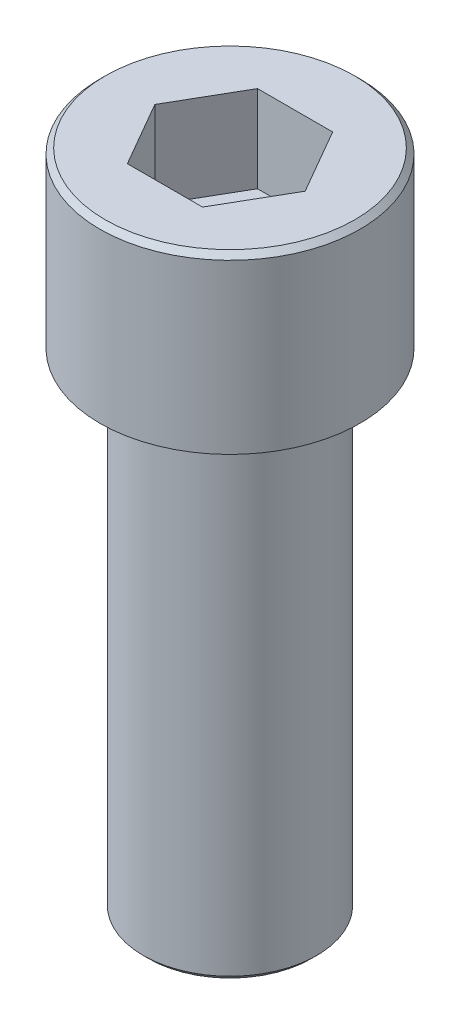
from build123d import *

# Parameters (mm, degrees)
CUT_EXTRUDE1_DEPTH = 8
CHAMFER1_SIZE      = 0.5
CUT_EXTRUDE2_DEPTH = 0.1


with BuildPart() as part:
    # Sketch1 → Base-Revolve (revolve)
    with BuildSketch(Plane.XY, mode=Mode.PRIVATE) as base_revolve_sk:
        Polygon((0, 0), (8, 0), (8, 45), (12, 45), (12, 61), (0, 61), align=None)
    revolve(base_revolve_sk.sketch.rotate(Axis((0, 0, 0), (0, 1, 0)), 90), axis=Axis((0, 0, 0), (0, 1, 0)))

    # Sketch2 → Cut-Extrude1 (cut)
    with BuildSketch(Plane(origin=(0, 61, 0), x_dir=(-1, 0, 0), z_dir=(0, 1, 0))):
        Polygon((3.464101615, -6), (-3.464101615, -6), (-6.92820323, 0), (-3.464101615, 6), (3.464101615, 6), (6.92820323, 0), align=None)
    extrude(amount=-CUT_EXTRUDE1_DEPTH, mode=Mode.SUBTRACT)

    # Chamfer1
    chamfer1_edges = [part.edges().sort_by_distance(p)[0] for p in [
        (0, 61, 12),
        (0, 0, 8),
    ]]
    chamfer(chamfer1_edges, length=CHAMFER1_SIZE)

    # Sketch3 → Cut-Extrude2 (cut)
    # profile 1 of 3: a face of its own
    with BuildSketch(Plane(origin=(0, 53, 0), x_dir=(1, 0, 0), z_dir=(0, 1, 0))):
        with BuildLine():
            add(Edge.make_bspline(
                [(-1.556991186, -1.607271635), (-1.536527938, -1.617941603), (-1.49661777, -1.638751605), (-1.439776907, -1.672259339), (-1.387830478, -1.707574314), (-1.339337219, -1.743028499), (-1.295149112, -1.779979679), (-1.255760245, -1.818574791), (-1.22019766, -1.857850466), (-1.189178528, -1.89847178), (-1.161895074, -1.940330815), (-1.138314977, -1.983537439), (-1.118159832, -2.027996963), (-1.102186304, -2.074194699), (-1.089027882, -2.121452028), (-1.079973878, -2.170379158), (-1.075104651, -2.220653688), (-1.07418407, -2.254631046), (-1.073717949, -2.271834936)],
                knots=[0, 0, 0, 0, 1.272397273, 2.481599622, 3.635517121, 4.734568067, 5.792894095, 6.808321871, 7.773003508, 8.711915296, 9.623354172, 10.525449501, 11.423591555, 12.311487226, 13.218079475, 14.126165749, 15.051214107, 16, 16, 16, 16], degree=3))
            add(Edge.make_bspline(
                [(-1.073717949, -2.271834936), (-1.074268963, -2.295904745), (-1.075359628, -2.343547928), (-1.084859617, -2.413866579), (-1.099083173, -2.482160709), (-1.119854253, -2.548415346), (-1.146792389, -2.612264898), (-1.179990129, -2.673764022), (-1.217569562, -2.733920671), (-1.247749732, -2.77093453), (-1.263020833, -2.789663462)],
                knots=[0, 0, 0, 0, 1.025265484, 2.029385089, 3.018602448, 3.995076438, 4.983346944, 5.966715145, 6.97116228, 8, 8, 8, 8], degree=3))
            add(Edge.make_bspline(
                [(-1.263020833, -2.789663462), (-1.282904029, -2.811516157), (-1.322424719, -2.854951509), (-1.39012681, -2.911344945), (-1.464428156, -2.958737369), (-1.54504125, -2.997360151), (-1.631750609, -3.027421479), (-1.724537755, -3.049023277), (-1.823583578, -3.061396441), (-1.891658915, -3.063185005), (-1.926582532, -3.064102564)],
                knots=[0, 0, 0, 0, 0.954267603, 1.896743057, 2.838368354, 3.796610408, 4.779680527, 5.799409237, 6.871065594, 8, 8, 8, 8], degree=3))
            add(Edge.make_bspline(
                [(-1.926582532, -3.064102564), (-1.960163524, -3.063279366), (-2.025508723, -3.061677505), (-2.120621493, -3.050824339), (-2.209280828, -3.031804435), (-2.292002234, -3.005772571), (-2.368287015, -2.971908122), (-2.437917802, -2.929759259), (-2.501899211, -2.881022514), (-2.558289549, -2.824298173), (-2.608352723, -2.76354255), (-2.652329904, -2.700862828), (-2.688882817, -2.636253287), (-2.719830742, -2.570677311), (-2.743522187, -2.503215772), (-2.759930909, -2.434215763), (-2.770351847, -2.363797803), (-2.771738372, -2.316275194), (-2.772435897, -2.292367788)],
                knots=[0, 0, 0, 0, 1.256902934, 2.445805442, 3.576955095, 4.645999104, 5.686449165, 6.692658513, 7.68621702, 8.689161843, 9.678783111, 10.630372946, 11.551080876, 12.453998257, 13.34127905, 14.221779781, 15.105423033, 16, 16, 16, 16], degree=3))
            add(Edge.make_bspline(
                [(-2.772435897, -2.292367788), (-2.772023125, -2.274825508), (-2.771207342, -2.240155771), (-2.765561022, -2.188934823), (-2.756483549, -2.139080441), (-2.744155366, -2.090408481), (-2.72744749, -2.043273286), (-2.707274538, -1.997451519), (-2.683751714, -1.952891449), (-2.656550882, -1.909349391), (-2.624906579, -1.867435453), (-2.589075401, -1.826438314), (-2.548341209, -1.786994124), (-2.503157167, -1.748620963), (-2.454039639, -1.710638124), (-2.399712831, -1.675098318), (-2.341616926, -1.639485486), (-2.30032735, -1.618193825), (-2.279146635, -1.607271635)],
                knots=[0, 0, 0, 0, 0.941657376, 1.861047343, 2.762797495, 3.66048619, 4.553285746, 5.444104102, 6.34607688, 7.256116206, 8.197091036, 9.162375105, 10.176350973, 11.237807142, 12.343728897, 13.50695164, 14.721116704, 16, 16, 16, 16], degree=3))
            add(Edge.make_bspline(
                [(-2.279146635, -1.607271635), (-2.308140474, -1.591461086), (-2.364280661, -1.560847437), (-2.438615977, -1.504599719), (-2.502466422, -1.443679851), (-2.554076934, -1.376801426), (-2.594699954, -1.306053659), (-2.622570386, -1.231879193), (-2.641425018, -1.155653397), (-2.643292751, -1.103577543), (-2.644230769, -1.077423878)],
                knots=[0, 0, 0, 0, 1.166880483, 2.259407225, 3.286803203, 4.280235371, 5.237608625, 6.161067461, 7.076446754, 8, 8, 8, 8], degree=3))
            add(Edge.make_bspline(
                [(-2.644230769, -1.077423878), (-2.643062609, -1.050782765), (-2.640714404, -0.997229482), (-2.621726318, -0.917510822), (-2.590783413, -0.839213276), (-2.548696986, -0.762716338), (-2.496277546, -0.690609042), (-2.433387156, -0.625936937), (-2.361527659, -0.569285878), (-2.281057754, -0.521731469), (-2.194460443, -0.483028856), (-2.103092068, -0.456329982), (-2.008544573, -0.438875613), (-1.944189059, -0.436899431), (-1.911558494, -0.435897436)],
                knots=[0, 0, 0, 0, 0.888701115, 1.786444228, 2.72001202, 3.692817113, 4.693886446, 5.687152267, 6.695133018, 7.739871481, 8.800368666, 9.853104506, 10.91144658, 12, 12, 12, 12], degree=3))
            add(Edge.make_bspline(
                [(-1.911558494, -0.435897436), (-1.879770054, -0.436930538), (-1.817086873, -0.438967698), (-1.724947854, -0.455958325), (-1.636787227, -0.484336554), (-1.552909014, -0.52283457), (-1.474814822, -0.570253814), (-1.405813173, -0.627683009), (-1.344861329, -0.692069831), (-1.294443904, -0.764155262), (-1.252898983, -0.840358258), (-1.223969768, -0.92008863), (-1.205432644, -1.001623672), (-1.203094527, -1.056793675), (-1.201923077, -1.084435096)],
                knots=[0, 0, 0, 0, 1.072916533, 2.115669174, 3.151510826, 4.193348718, 5.225979165, 6.227137561, 7.216255879, 8.211077061, 9.189680878, 10.138522389, 11.067357538, 12, 12, 12, 12], degree=3))
            add(Edge.make_bspline(
                [(-1.201923077, -1.084435096), (-1.202947763, -1.111561285), (-1.204960188, -1.164835577), (-1.221888717, -1.242497377), (-1.250398226, -1.315227405), (-1.289322629, -1.383850942), (-1.34005512, -1.447123441), (-1.4019185, -1.505849491), (-1.474419556, -1.560511511), (-1.528891618, -1.591358914), (-1.556991186, -1.607271635)],
                knots=[0, 0, 0, 0, 0.975232327, 1.915300861, 2.843280834, 3.77672583, 4.742871857, 5.749627742, 6.839139064, 8, 8, 8, 8], degree=3))
        make_face()
        with BuildLine():
            add(Edge.make_bspline(
                [(-1.924078526, -0.692307692), (-1.941614816, -0.692773007), (-1.975923466, -0.693683366), (-2.02622966, -0.698439535), (-2.074067065, -0.707691833), (-2.119935494, -0.720005198), (-2.163206074, -0.736639476), (-2.204466471, -0.756207339), (-2.243014463, -0.779997386), (-2.279315394, -0.806683956), (-2.311994519, -0.836036032), (-2.34099777, -0.86661726), (-2.36508928, -0.899028254), (-2.385547215, -0.932462797), (-2.400391156, -0.967913208), (-2.411508516, -1.00429262), (-2.419023796, -1.042060751), (-2.419586932, -1.067872545), (-2.419871795, -1.080929487)],
                knots=[0, 0, 0, 0, 1.203892937, 2.355340988, 3.463153438, 4.544400666, 5.610487187, 6.640501085, 7.674077295, 8.714426146, 9.728707835, 10.68524104, 11.601827946, 12.495867327, 13.368432065, 14.231010473, 15.105153427, 16, 16, 16, 16], degree=3))
            add(Edge.make_bspline(
                [(-2.419871795, -1.080929487), (-2.419380819, -1.093986994), (-2.418410579, -1.119790503), (-2.410906916, -1.157894693), (-2.399723448, -1.195338719), (-2.382115833, -1.231232227), (-2.360997005, -1.266820341), (-2.334931665, -1.301213617), (-2.303868074, -1.334531749), (-2.268848474, -1.36649135), (-2.230697375, -1.396419038), (-2.190280202, -1.422399882), (-2.148104208, -1.444138532), (-2.10460273, -1.462230964), (-2.05933241, -1.476295205), (-2.012570643, -1.486272809), (-1.96430957, -1.492474236), (-1.931609156, -1.493214965), (-1.915064103, -1.493589744)],
                knots=[0, 0, 0, 0, 0.873023192, 1.725219244, 2.590779336, 3.480155217, 4.391973325, 5.357036234, 6.360879153, 7.436073238, 8.526419356, 9.601555421, 10.645666583, 11.697338044, 12.750135903, 13.812665442, 14.89329948, 16, 16, 16, 16], degree=3))
            add(Edge.make_bspline(
                [(-1.915064103, -1.493589744), (-1.893814028, -1.492966267), (-1.851523766, -1.491725472), (-1.789181386, -1.480188919), (-1.728565212, -1.462041835), (-1.670323137, -1.437213288), (-1.615962719, -1.406050531), (-1.567505527, -1.368741232), (-1.52536489, -1.326146877), (-1.489978739, -1.278930566), (-1.462543135, -1.228679431), (-1.441184701, -1.178250651), (-1.428712404, -1.1271062), (-1.42708557, -1.092844083), (-1.426282051, -1.075921474)],
                knots=[0, 0, 0, 0, 1.076279235, 2.141928126, 3.20205304, 4.278698113, 5.344010996, 6.36967002, 7.368914609, 8.37248503, 9.349703398, 10.264243087, 11.142681841, 12, 12, 12, 12], degree=3))
            add(Edge.make_bspline(
                [(-1.426282051, -1.075921474), (-1.426661978, -1.064044306), (-1.427416078, -1.040469829), (-1.433630404, -1.005656711), (-1.443898856, -0.97163558), (-1.457801056, -0.938125386), (-1.476093767, -0.905596292), (-1.497782472, -0.873536943), (-1.524128545, -0.842668541), (-1.553697426, -0.81227172), (-1.58722986, -0.784140275), (-1.624661226, -0.759401196), (-1.665799619, -0.73839237), (-1.710646012, -0.721328974), (-1.759035244, -0.70851301), (-1.81074444, -0.698915618), (-1.866204759, -0.693506253), (-1.904368867, -0.692715878), (-1.924078526, -0.692307692)],
                knots=[0, 0, 0, 0, 0.814439003, 1.616544685, 2.417341072, 3.248991801, 4.09997495, 4.973547432, 5.9003056, 6.880240646, 7.880314356, 8.896779544, 9.951930927, 11.043077905, 12.18215768, 13.381699519, 14.647792085, 16, 16, 16, 16], degree=3))
        make_face(mode=Mode.SUBTRACT)
        with BuildLine():
            add(Edge.make_bspline(
                [(-1.909555288, -1.75), (-1.931787992, -1.750395458), (-1.975403133, -1.75117125), (-2.039300939, -1.759806608), (-2.100624628, -1.771827603), (-2.15916744, -1.790063916), (-2.214904652, -1.813775695), (-2.268137997, -1.842300366), (-2.318460232, -1.87601854), (-2.365176465, -1.914501837), (-2.407835986, -1.955972875), (-2.445263343, -1.9998744), (-2.477047287, -2.045390495), (-2.502642466, -2.093099231), (-2.523650846, -2.141990381), (-2.537446472, -2.193281521), (-2.546290552, -2.245986601), (-2.547478146, -2.281815243), (-2.548076923, -2.299879808)],
                knots=[0, 0, 0, 0, 1.140299081, 2.23698856, 3.303958914, 4.344563908, 5.37730929, 6.408454204, 7.439741482, 8.480804886, 9.510774543, 10.48932336, 11.43758569, 12.353841022, 13.263987381, 14.161954604, 15.073269652, 16, 16, 16, 16], degree=3))
            add(Edge.make_bspline(
                [(-2.548076923, -2.299879808), (-2.547103167, -2.322330455), (-2.545171257, -2.366872014), (-2.529845087, -2.43270278), (-2.505248275, -2.496432105), (-2.47094455, -2.557540642), (-2.428467712, -2.614647861), (-2.376234521, -2.664425558), (-2.317491065, -2.708655185), (-2.250249741, -2.744426995), (-2.176800837, -2.772994749), (-2.097163887, -2.792677579), (-2.012481803, -2.805707186), (-1.954010665, -2.807020173), (-1.924078526, -2.807692308)],
                knots=[0, 0, 0, 0, 0.898778495, 1.783155532, 2.693654817, 3.627872908, 4.583023416, 5.533784346, 6.509005473, 7.520592997, 8.575161974, 9.658835044, 10.801527049, 12, 12, 12, 12], degree=3))
            add(Edge.make_bspline(
                [(-1.924078526, -2.807692308), (-1.900685406, -2.807243159), (-1.855108106, -2.806368073), (-1.788618143, -2.798643577), (-1.725872037, -2.786393845), (-1.666991466, -2.768577027), (-1.611317295, -2.746827043), (-1.559793471, -2.718846985), (-1.511094523, -2.687023897), (-1.46762015, -2.649268071), (-1.428025, -2.608925575), (-1.39350122, -2.566218401), (-1.363531541, -2.522307235), (-1.340009429, -2.476199746), (-1.321204962, -2.428780521), (-1.307688138, -2.379612299), (-1.299347984, -2.328544276), (-1.298504487, -2.293902082), (-1.298076923, -2.276342147)],
                knots=[0, 0, 0, 0, 1.224942928, 2.386581632, 3.501229538, 4.569074225, 5.605009692, 6.626002462, 7.634866581, 8.645888296, 9.63523824, 10.59253846, 11.518950513, 12.414518923, 13.29783783, 14.186679152, 15.080837789, 16, 16, 16, 16], degree=3))
            add(Edge.make_bspline(
                [(-1.298076923, -2.276342147), (-1.298723958, -2.259286904), (-1.299999797, -2.225656944), (-1.308097434, -2.17582371), (-1.32232306, -2.127678843), (-1.341842629, -2.080643125), (-1.367829031, -2.035669588), (-1.39843251, -1.991586609), (-1.43535688, -1.94961772), (-1.477080163, -1.909436937), (-1.52255085, -1.872282839), (-1.570884525, -1.839415383), (-1.62170914, -1.8117353), (-1.674917148, -1.789223518), (-1.730390402, -1.771518182), (-1.788088101, -1.759149614), (-1.848077798, -1.751364184), (-1.888831277, -1.750459865), (-1.909555288, -1.75)],
                knots=[0, 0, 0, 0, 0.917430815, 1.809013306, 2.70690318, 3.612392954, 4.541220862, 5.495268465, 6.494511384, 7.542276156, 8.608045339, 9.649016899, 10.681629292, 11.715607085, 12.752076957, 13.808767841, 14.885711793, 16, 16, 16, 16], degree=3))
        make_face(mode=Mode.SUBTRACT)
    # profile 2 of 3: a face of its own
    with BuildSketch(Plane(origin=(0, 53, 0), x_dir=(1, 0, 0), z_dir=(0, 1, 0))):
        with BuildLine():
            add(Edge.make_bspline(
                [(-0.448717949, -2.615384615), (-0.434796369, -2.616211877), (-0.407504738, -2.617833628), (-0.368048218, -2.628959823), (-0.332337747, -2.648716009), (-0.300529001, -2.675046565), (-0.274310089, -2.706972039), (-0.253849837, -2.742397688), (-0.242820562, -2.78218454), (-0.241210625, -2.809634308), (-0.240384615, -2.823717949)],
                knots=[0, 0, 0, 0, 1.020151414, 1.999887582, 2.974338812, 3.990962822, 5.007586832, 5.987933904, 6.967670073, 8, 8, 8, 8], degree=3))
            add(Edge.make_bspline(
                [(-0.240384615, -2.823717949), (-0.241238616, -2.837463184), (-0.242922692, -2.864568587), (-0.253824555, -2.904055346), (-0.27446602, -2.939503135), (-0.300348158, -2.971861805), (-0.33234561, -2.998248141), (-0.368132643, -3.017836244), (-0.407412113, -3.029759087), (-0.434780916, -3.031277871), (-0.448717949, -3.032051282)],
                knots=[0, 0, 0, 0, 1.009421747, 1.99056486, 2.972319754, 3.999869655, 5.017953583, 5.993804169, 6.978383603, 8, 8, 8, 8], degree=3))
            add(Edge.make_bspline(
                [(-0.448717949, -3.032051282), (-0.462665024, -3.031305855), (-0.489893369, -3.029850588), (-0.529026222, -3.01759144), (-0.565031199, -2.998431826), (-0.597022422, -2.971812605), (-0.62312133, -2.939669645), (-0.642853747, -2.903811219), (-0.654703853, -2.864681621), (-0.656262334, -2.837485448), (-0.657051282, -2.823717949)],
                knots=[0, 0, 0, 0, 1.022052826, 1.995314843, 2.982371812, 4.00089066, 5.028879526, 6.005146991, 6.990147033, 8, 8, 8, 8], degree=3))
            add(Edge.make_bspline(
                [(-0.657051282, -2.823717949), (-0.65629264, -2.809611249), (-0.654811484, -2.782069649), (-0.642828869, -2.742641715), (-0.623274432, -2.706807116), (-0.596842007, -2.675095273), (-0.565038939, -2.648532914), (-0.529113078, -2.629200919), (-0.48979912, -2.617743481), (-0.462649164, -2.616184541), (-0.448717949, -2.615384615)],
                knots=[0, 0, 0, 0, 1.032775665, 2.016367738, 2.991239715, 4.008302682, 5.025365648, 6.011011707, 6.979408107, 8, 8, 8, 8], degree=3))
        make_face()
    # profile 3 of 3: a face of its own
    with BuildSketch(Plane(origin=(0, 53, 0), x_dir=(1, 0, 0), z_dir=(0, 1, 0))):
        with BuildLine():
            add(Edge.make_bspline(
                [(1.295572917, -1.607271635), (1.316036165, -1.617941603), (1.355946332, -1.638751605), (1.412787195, -1.672259339), (1.464733625, -1.707574314), (1.513226883, -1.743028499), (1.557414991, -1.779979679), (1.596803857, -1.818574791), (1.632366443, -1.857850466), (1.663385574, -1.89847178), (1.690669029, -1.940330815), (1.714249126, -1.983537439), (1.73440427, -2.027996963), (1.750377798, -2.074194699), (1.763536221, -2.121452028), (1.772590224, -2.170379158), (1.777459451, -2.220653688), (1.778380032, -2.254631046), (1.778846154, -2.271834936)],
                knots=[0, 0, 0, 0, 1.272397273, 2.481599622, 3.635517121, 4.734568067, 5.792894095, 6.808321871, 7.773003508, 8.711915296, 9.623354172, 10.525449501, 11.423591555, 12.311487226, 13.218079475, 14.126165749, 15.051214107, 16, 16, 16, 16], degree=3))
            add(Edge.make_bspline(
                [(1.778846154, -2.271834936), (1.778295139, -2.295904745), (1.777204474, -2.343547928), (1.767704486, -2.413866579), (1.75348093, -2.482160709), (1.73270985, -2.548415346), (1.705771713, -2.612264898), (1.672573973, -2.673764022), (1.634994541, -2.733920671), (1.60481437, -2.77093453), (1.589543269, -2.789663462)],
                knots=[0, 0, 0, 0, 1.025265484, 2.029385089, 3.018602448, 3.995076438, 4.983346944, 5.966715145, 6.97116228, 8, 8, 8, 8], degree=3))
            add(Edge.make_bspline(
                [(1.589543269, -2.789663462), (1.569660073, -2.811516157), (1.530139384, -2.854951509), (1.462437292, -2.911344945), (1.388135947, -2.958737369), (1.307522852, -2.997360151), (1.220813494, -3.027421479), (1.128026348, -3.049023277), (1.028980524, -3.061396441), (0.960905188, -3.063185005), (0.925981571, -3.064102564)],
                knots=[0, 0, 0, 0, 0.954267603, 1.896743057, 2.838368354, 3.796610408, 4.779680527, 5.799409237, 6.871065594, 8, 8, 8, 8], degree=3))
            add(Edge.make_bspline(
                [(0.925981571, -3.064102564), (0.892400579, -3.063279366), (0.827055379, -3.061677505), (0.73194261, -3.050824339), (0.643283274, -3.031804435), (0.560561868, -3.005772571), (0.484277087, -2.971908122), (0.414646301, -2.929759259), (0.350664892, -2.881022514), (0.294274554, -2.824298173), (0.244211379, -2.76354255), (0.200234199, -2.700862828), (0.163681285, -2.636253287), (0.13273336, -2.570677311), (0.109041915, -2.503215772), (0.092633194, -2.434215763), (0.082212255, -2.363797803), (0.08082573, -2.316275194), (0.080128205, -2.292367788)],
                knots=[0, 0, 0, 0, 1.256902934, 2.445805442, 3.576955095, 4.645999104, 5.686449165, 6.692658513, 7.68621702, 8.689161843, 9.678783111, 10.630372946, 11.551080876, 12.453998257, 13.34127905, 14.221779781, 15.105423033, 16, 16, 16, 16], degree=3))
            add(Edge.make_bspline(
                [(0.080128205, -2.292367788), (0.080540977, -2.274825508), (0.081356761, -2.240155771), (0.087003081, -2.188934823), (0.096080553, -2.139080441), (0.108408737, -2.090408481), (0.125116613, -2.043273286), (0.145289565, -1.997451519), (0.168812388, -1.952891449), (0.19601322, -1.909349391), (0.227657523, -1.867435453), (0.263488702, -1.826438314), (0.304222894, -1.786994124), (0.349406936, -1.748620963), (0.398524464, -1.710638124), (0.452851271, -1.675098318), (0.510947177, -1.639485486), (0.552236752, -1.618193825), (0.573417468, -1.607271635)],
                knots=[0, 0, 0, 0, 0.941657376, 1.861047343, 2.762797495, 3.66048619, 4.553285746, 5.444104102, 6.34607688, 7.256116206, 8.197091036, 9.162375105, 10.176350973, 11.237807142, 12.343728897, 13.50695164, 14.721116704, 16, 16, 16, 16], degree=3))
            add(Edge.make_bspline(
                [(0.573417468, -1.607271635), (0.544423629, -1.591461086), (0.488283441, -1.560847437), (0.413948126, -1.504599719), (0.350097681, -1.443679851), (0.298487168, -1.376801426), (0.257864148, -1.306053659), (0.229993716, -1.231879193), (0.211139085, -1.155653397), (0.209271351, -1.103577543), (0.208333333, -1.077423878)],
                knots=[0, 0, 0, 0, 1.166880483, 2.259407225, 3.286803203, 4.280235371, 5.237608625, 6.161067461, 7.076446754, 8, 8, 8, 8], degree=3))
            add(Edge.make_bspline(
                [(0.208333333, -1.077423878), (0.209501493, -1.050782765), (0.211849699, -0.997229482), (0.230837785, -0.917510822), (0.26178069, -0.839213276), (0.303867116, -0.762716338), (0.356286556, -0.690609042), (0.419176946, -0.625936937), (0.491036444, -0.569285878), (0.571506349, -0.521731469), (0.65810366, -0.483028856), (0.749472034, -0.456329982), (0.844019529, -0.438875613), (0.908375043, -0.436899431), (0.941005609, -0.435897436)],
                knots=[0, 0, 0, 0, 0.888701115, 1.786444228, 2.72001202, 3.692817113, 4.693886446, 5.687152267, 6.695133018, 7.739871481, 8.800368666, 9.853104506, 10.91144658, 12, 12, 12, 12], degree=3))
            add(Edge.make_bspline(
                [(0.941005609, -0.435897436), (0.972794048, -0.436930538), (1.035477229, -0.438967698), (1.127616249, -0.455958325), (1.215776876, -0.484336554), (1.299655089, -0.52283457), (1.37774928, -0.570253814), (1.44675093, -0.627683009), (1.507702774, -0.692069831), (1.558120198, -0.764155262), (1.599665119, -0.840358258), (1.628594334, -0.92008863), (1.647131459, -1.001623672), (1.649469576, -1.056793675), (1.650641026, -1.084435096)],
                knots=[0, 0, 0, 0, 1.072916533, 2.115669174, 3.151510826, 4.193348718, 5.225979165, 6.227137561, 7.216255879, 8.211077061, 9.189680878, 10.138522389, 11.067357538, 12, 12, 12, 12], degree=3))
            add(Edge.make_bspline(
                [(1.650641026, -1.084435096), (1.649616339, -1.111561285), (1.647603914, -1.164835577), (1.630675386, -1.242497377), (1.602165876, -1.315227405), (1.563241474, -1.383850942), (1.512508983, -1.447123441), (1.450645602, -1.505849491), (1.378144546, -1.560511511), (1.323672485, -1.591358914), (1.295572917, -1.607271635)],
                knots=[0, 0, 0, 0, 0.975232327, 1.915300861, 2.843280834, 3.77672583, 4.742871857, 5.749627742, 6.839139064, 8, 8, 8, 8], degree=3))
        make_face()
        with BuildLine():
            add(Edge.make_bspline(
                [(0.928485577, -0.692307692), (0.910949287, -0.692773007), (0.876640636, -0.693683366), (0.826334443, -0.698439535), (0.778497037, -0.707691833), (0.732628608, -0.720005198), (0.689358028, -0.736639476), (0.648097632, -0.756207339), (0.609549639, -0.779997386), (0.573248709, -0.806683956), (0.540569584, -0.836036032), (0.511566333, -0.86661726), (0.487474823, -0.899028254), (0.467016887, -0.932462797), (0.452172946, -0.967913208), (0.441055586, -1.00429262), (0.433540307, -1.042060751), (0.432977171, -1.067872545), (0.432692308, -1.080929487)],
                knots=[0, 0, 0, 0, 1.203892937, 2.355340988, 3.463153438, 4.544400666, 5.610487187, 6.640501085, 7.674077295, 8.714426146, 9.728707835, 10.68524104, 11.601827946, 12.495867327, 13.368432065, 14.231010473, 15.105153427, 16, 16, 16, 16], degree=3))
            add(Edge.make_bspline(
                [(0.432692308, -1.080929487), (0.433183284, -1.093986994), (0.434153524, -1.119790503), (0.441657187, -1.157894693), (0.452840654, -1.195338719), (0.47044827, -1.231232227), (0.491567097, -1.266820341), (0.517632437, -1.301213617), (0.548696029, -1.334531749), (0.583715629, -1.36649135), (0.621866727, -1.396419038), (0.662283901, -1.422399882), (0.704459895, -1.444138532), (0.747961373, -1.462230964), (0.793231692, -1.476295205), (0.839993459, -1.486272809), (0.888254532, -1.492474236), (0.920954947, -1.493214965), (0.9375, -1.493589744)],
                knots=[0, 0, 0, 0, 0.873023192, 1.725219244, 2.590779336, 3.480155217, 4.391973325, 5.357036234, 6.360879153, 7.436073238, 8.526419356, 9.601555421, 10.645666583, 11.697338044, 12.750135903, 13.812665442, 14.89329948, 16, 16, 16, 16], degree=3))
            add(Edge.make_bspline(
                [(0.9375, -1.493589744), (0.958750074, -1.492966267), (1.001040337, -1.491725472), (1.063382716, -1.480188919), (1.123998891, -1.462041835), (1.182240966, -1.437213288), (1.236601384, -1.406050531), (1.285058575, -1.368741232), (1.327199213, -1.326146877), (1.362585363, -1.278930566), (1.390020968, -1.228679431), (1.411379402, -1.178250651), (1.423851699, -1.1271062), (1.425478532, -1.092844083), (1.426282051, -1.075921474)],
                knots=[0, 0, 0, 0, 1.076279235, 2.141928126, 3.20205304, 4.278698113, 5.344010996, 6.36967002, 7.368914609, 8.37248503, 9.349703398, 10.264243087, 11.142681841, 12, 12, 12, 12], degree=3))
            add(Edge.make_bspline(
                [(1.426282051, -1.075921474), (1.425902124, -1.064044306), (1.425148024, -1.040469829), (1.418933698, -1.005656711), (1.408665246, -0.97163558), (1.394763046, -0.938125386), (1.376470336, -0.905596292), (1.35478163, -0.873536943), (1.328435558, -0.842668541), (1.298866677, -0.81227172), (1.265334242, -0.784140275), (1.227902876, -0.759401196), (1.186764483, -0.73839237), (1.14191809, -0.721328974), (1.093528859, -0.70851301), (1.041819663, -0.698915618), (0.986359343, -0.693506253), (0.948195236, -0.692715878), (0.928485577, -0.692307692)],
                knots=[0, 0, 0, 0, 0.814439003, 1.616544685, 2.417341072, 3.248991801, 4.09997495, 4.973547432, 5.9003056, 6.880240646, 7.880314356, 8.896779544, 9.951930927, 11.043077905, 12.18215768, 13.381699519, 14.647792085, 16, 16, 16, 16], degree=3))
        make_face(mode=Mode.SUBTRACT)
        with BuildLine():
            add(Edge.make_bspline(
                [(0.943008814, -1.75), (0.92077611, -1.750395458), (0.87716097, -1.75117125), (0.813263164, -1.759806608), (0.751939474, -1.771827603), (0.693396663, -1.790063916), (0.637659451, -1.813775695), (0.584426106, -1.842300366), (0.53410387, -1.87601854), (0.487387637, -1.914501837), (0.444728116, -1.955972875), (0.407300759, -1.9998744), (0.375516816, -2.045390495), (0.349921637, -2.093099231), (0.328913257, -2.141990381), (0.31511763, -2.193281521), (0.30627355, -2.245986601), (0.305085957, -2.281815243), (0.304487179, -2.299879808)],
                knots=[0, 0, 0, 0, 1.140299081, 2.23698856, 3.303958914, 4.344563908, 5.37730929, 6.408454204, 7.439741482, 8.480804886, 9.510774543, 10.48932336, 11.43758569, 12.353841022, 13.263987381, 14.161954604, 15.073269652, 16, 16, 16, 16], degree=3))
            add(Edge.make_bspline(
                [(0.304487179, -2.299879808), (0.305460936, -2.322330455), (0.307392845, -2.366872014), (0.322719016, -2.43270278), (0.347315827, -2.496432105), (0.381619553, -2.557540642), (0.42409639, -2.614647861), (0.476329582, -2.664425558), (0.535073037, -2.708655185), (0.602314362, -2.744426995), (0.675763266, -2.772994749), (0.755400215, -2.792677579), (0.8400823, -2.805707186), (0.898553437, -2.807020173), (0.928485577, -2.807692308)],
                knots=[0, 0, 0, 0, 0.898778495, 1.783155532, 2.693654817, 3.627872908, 4.583023416, 5.533784346, 6.509005473, 7.520592997, 8.575161974, 9.658835044, 10.801527049, 12, 12, 12, 12], degree=3))
            add(Edge.make_bspline(
                [(0.928485577, -2.807692308), (0.951878697, -2.807243159), (0.997455996, -2.806368073), (1.06394596, -2.798643577), (1.126692066, -2.786393845), (1.185572636, -2.768577027), (1.241246807, -2.746827043), (1.292770632, -2.718846985), (1.34146958, -2.687023897), (1.384943953, -2.649268071), (1.424539102, -2.608925575), (1.459062882, -2.566218401), (1.489032562, -2.522307235), (1.512554673, -2.476199746), (1.53135914, -2.428780521), (1.544875965, -2.379612299), (1.553216119, -2.328544276), (1.554059616, -2.293902082), (1.554487179, -2.276342147)],
                knots=[0, 0, 0, 0, 1.224942928, 2.386581632, 3.501229538, 4.569074225, 5.605009692, 6.626002462, 7.634866581, 8.645888296, 9.63523824, 10.59253846, 11.518950513, 12.414518923, 13.29783783, 14.186679152, 15.080837789, 16, 16, 16, 16], degree=3))
            add(Edge.make_bspline(
                [(1.554487179, -2.276342147), (1.553840145, -2.259286904), (1.552564305, -2.225656944), (1.544466669, -2.17582371), (1.530241042, -2.127678843), (1.510721473, -2.080643125), (1.484735071, -2.035669588), (1.454131593, -1.991586609), (1.417207222, -1.94961772), (1.375483939, -1.909436937), (1.330013253, -1.872282839), (1.281679578, -1.839415383), (1.230854962, -1.8117353), (1.177646955, -1.789223518), (1.1221737, -1.771518182), (1.064476001, -1.759149614), (1.004486305, -1.751364184), (0.963732826, -1.750459865), (0.943008814, -1.75)],
                knots=[0, 0, 0, 0, 0.917430815, 1.809013306, 2.70690318, 3.612392954, 4.541220862, 5.495268465, 6.494511384, 7.542276156, 8.608045339, 9.649016899, 10.681629292, 11.715607085, 12.752076957, 13.808767841, 14.885711793, 16, 16, 16, 16], degree=3))
        make_face(mode=Mode.SUBTRACT)
    extrude(amount=-CUT_EXTRUDE2_DEPTH, mode=Mode.SUBTRACT)


solid = part.part
